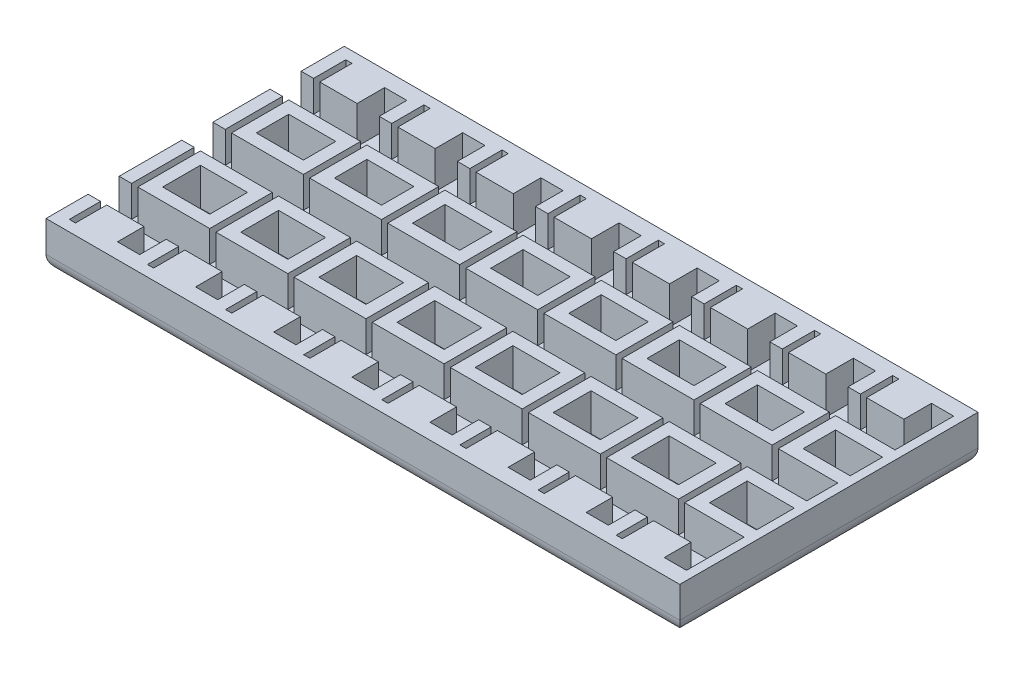
from build123d import *

# Parameters (mm, degrees)
SKETCH1_W                                    = 204
SKETCH1_H                                    = 96
BOSS_EXTRUDE1_DEPTH                          = 15
SKETCH2_W                                    = 2
SKETCH2_H                                    = 89
CUT_EXTRUDE1_DEPTH                           = 10
SKETCH3_W                                    = 8
SKETCH3_H                                    = 10
CUT_EXTRUDE2_DEPTH                           = 12
FILLET1_R                                    = 5
SKETCH5_W                                    = 15.146
SKETCH5_H                                    = 10.425
SKETCH5_H_2                                  = 12.15
SKETCH5_W_2                                  = 7.146
SKETCH5_H_3                                  = 10
SKETCH5_H_4                                  = 18.875
SKETCH5_H_5                                  = 18.55
CUT_EXTRUDE3_DEPTH                           = 12
LPATTERN1_COUNT                              = 8
LPATTERN1_PITCH                              = 25.146
CSK_FOR_M4_HEX_SOCKET_COUNTERSUNK_CA_2_COUNT = 2
CSK_FOR_M4_HEX_SOCKET_COUNTERSUNK_CA_2_PITCH = 129.241712231
CSK_FOR_M4_HEX_SOCKET_COUNTERSUNK_CA_3_COUNT = 2
CSK_FOR_M4_HEX_SOCKET_COUNTERSUNK_CA_3_PITCH = 125.709217873
CSK_FOR_M4_HEX_SOCKET_COUNTERSUNK_CA_4_COUNT = 2
CSK_FOR_M4_HEX_SOCKET_COUNTERSUNK_CA_4_PITCH = 29.040465592
SKETCH9_W                                    = 201.168
SKETCH9_H                                    = 10
CUT_EXTRUDE4_DEPTH                           = 12


with BuildPart() as part:
    # Sketch1 → Boss-Extrude1 (new body)
    with BuildSketch(Plane(origin=(0, 0, 0), x_dir=(1, 0, 0), z_dir=(0, 1, 0))):
        Rectangle(SKETCH1_W, SKETCH1_H)
    extrude(amount=BOSS_EXTRUDE1_DEPTH)

    # Sketch2 → Cut-Extrude1 (cut)
    with BuildSketch(Plane(origin=(0, 15, 0), x_dir=(1, 0, 0), z_dir=(0, 1, 0))):
        with Locations((-97, 0)):
            Rectangle(SKETCH2_W, SKETCH2_H)
        with Locations((-71.854, 0)):
            Rectangle(SKETCH2_W, SKETCH2_H)
        with Locations((-46.708, 0)):
            Rectangle(SKETCH2_W, SKETCH2_H)
        with Locations((-21.562, 0)):
            Rectangle(SKETCH2_W, SKETCH2_H)
        with Locations((3.584, 0)):
            Rectangle(SKETCH2_W, SKETCH2_H)
        with Locations((28.73, 0)):
            Rectangle(SKETCH2_W, SKETCH2_H)
        with Locations((53.876, 0)):
            Rectangle(SKETCH2_W, SKETCH2_H)
        with Locations((79.022, 0)):
            Rectangle(SKETCH2_W, SKETCH2_H)
    extrude(amount=-CUT_EXTRUDE1_DEPTH, mode=Mode.SUBTRACT)

    # Sketch3 → Cut-Extrude2 (cut)
    with BuildSketch(Plane(origin=(0, 15, 0), x_dir=(1, 0, 0), z_dir=(0, 1, 0))):
        with Locations((-92, 0.7)):
            Rectangle(SKETCH3_W, SKETCH3_H)
        with Locations((-92, 29.125)):
            Rectangle(SKETCH3_W, SKETCH3_H)
        with Locations((-92, -29.45)):
            Rectangle(SKETCH3_W, SKETCH3_H)
        with Locations((-66.854, 29.125)):
            Rectangle(SKETCH3_W, SKETCH3_H)
        with Locations((-66.854, 0.7)):
            Rectangle(SKETCH3_W, SKETCH3_H)
        with Locations((-66.854, -29.45)):
            Rectangle(SKETCH3_W, SKETCH3_H)
        with Locations((-41.708, 29.125)):
            Rectangle(SKETCH3_W, SKETCH3_H)
        with Locations((-41.708, 0.7)):
            Rectangle(SKETCH3_W, SKETCH3_H)
        with Locations((-41.708, -29.45)):
            Rectangle(SKETCH3_W, SKETCH3_H)
        with Locations((-16.562, 29.125)):
            Rectangle(SKETCH3_W, SKETCH3_H)
        with Locations((-16.562, 0.7)):
            Rectangle(SKETCH3_W, SKETCH3_H)
        with Locations((-16.562, -29.45)):
            Rectangle(SKETCH3_W, SKETCH3_H)
        with Locations((8.584, 29.125)):
            Rectangle(SKETCH3_W, SKETCH3_H)
        with Locations((8.584, 0.7)):
            Rectangle(SKETCH3_W, SKETCH3_H)
        with Locations((8.584, -29.45)):
            Rectangle(SKETCH3_W, SKETCH3_H)
        with Locations((33.73, 29.125)):
            Rectangle(SKETCH3_W, SKETCH3_H)
        with Locations((33.73, 0.7)):
            Rectangle(SKETCH3_W, SKETCH3_H)
        with Locations((33.73, -29.45)):
            Rectangle(SKETCH3_W, SKETCH3_H)
        with Locations((58.876, 29.125)):
            Rectangle(SKETCH3_W, SKETCH3_H)
        with Locations((58.876, 0.7)):
            Rectangle(SKETCH3_W, SKETCH3_H)
        with Locations((58.876, -29.45)):
            Rectangle(SKETCH3_W, SKETCH3_H)
        with Locations((84.022, 29.125)):
            Rectangle(SKETCH3_W, SKETCH3_H)
        with Locations((84.022, 0.7)):
            Rectangle(SKETCH3_W, SKETCH3_H)
        with Locations((84.022, -29.45)):
            Rectangle(SKETCH3_W, SKETCH3_H)
    extrude(amount=-CUT_EXTRUDE2_DEPTH, mode=Mode.SUBTRACT)

    # Fillet1
    fillet1_edges = [part.edges().sort_by_distance(p)[0] for p in [
        (0, 0, 48),
        (-102, 0, 0),
        (0, 0, -48),
        (102, 0, 0),
    ]]
    fillet(fillet1_edges, radius=FILLET1_R)

    # Sketch5 → Cut-Extrude3 (cut)
    with BuildSketch(Plane(origin=(0, 15, 0), x_dir=(1, 0, 0), z_dir=(0, 1, 0))):
        with Locations((-84.427, 14.9125)):
            Rectangle(SKETCH5_W, SKETCH5_H)
        with Locations((-84.427, -14.375)):
            Rectangle(SKETCH5_W, SKETCH5_H_2)
        with Locations((-80.427, 0.7)):
            Rectangle(SKETCH5_W_2, SKETCH5_H_3)
        with Locations((-80.427, 33.5625)):
            Rectangle(SKETCH5_W_2, SKETCH5_H_4)
        with Locations((-80.427, -33.725)):
            Rectangle(SKETCH5_W_2, SKETCH5_H_5)
    cut_extrude3 = extrude(amount=-CUT_EXTRUDE3_DEPTH, mode=Mode.SUBTRACT)

    # LPattern1: Cut-Extrude3 ×8
    with Locations(*[(i * LPATTERN1_PITCH, 0, 0) for i in range(1, LPATTERN1_COUNT)]):
        add(cut_extrude3, mode=Mode.SUBTRACT)

    # Sketch8 → CSK for M4 Hex Socket Countersunk Cap Screw1 (revolve, cut)
    with BuildSketch(Plane(origin=(-59.360217873, 3, -14.665465592), x_dir=(0, 0, 1), z_dir=(1, 0, 0))):
        Polygon((0, 0), (0, 3), (2.25, 3), (2.25, 2.23), (4.48, 0), align=None)
    csk_for_m4_hex_socket_countersunk_cap_sc = revolve(axis=Axis((-59.360217873, 9.35, -14.665465592), (0, -1, 0)), mode=Mode.SUBTRACT)

    # CSK for M4 Hex Socket Countersunk Ca 2: CSK for M4 Hex Socket Countersunk Cap Screw1 ×2
    with Locations(*[Vector(0.9744282537243548, 0, 0.22469886146508294) * (i * CSK_FOR_M4_HEX_SOCKET_COUNTERSUNK_CA_2_PITCH) for i in range(1, CSK_FOR_M4_HEX_SOCKET_COUNTERSUNK_CA_2_COUNT)]):
        add(csk_for_m4_hex_socket_countersunk_cap_sc, mode=Mode.SUBTRACT)

    # CSK for M4 Hex Socket Countersunk Ca 3: CSK for M4 Hex Socket Countersunk Cap Screw1 ×2
    with Locations(*[(i * CSK_FOR_M4_HEX_SOCKET_COUNTERSUNK_CA_3_PITCH, 0, 0) for i in range(1, CSK_FOR_M4_HEX_SOCKET_COUNTERSUNK_CA_3_COUNT)]):
        add(csk_for_m4_hex_socket_countersunk_cap_sc, mode=Mode.SUBTRACT)

    # CSK for M4 Hex Socket Countersunk Ca 4: CSK for M4 Hex Socket Countersunk Cap Screw1 ×2
    with Locations(*[(0, 0, i * CSK_FOR_M4_HEX_SOCKET_COUNTERSUNK_CA_4_PITCH) for i in range(1, CSK_FOR_M4_HEX_SOCKET_COUNTERSUNK_CA_4_COUNT)]):
        add(csk_for_m4_hex_socket_countersunk_cap_sc, mode=Mode.SUBTRACT)

    # Sketch9 → Cut-Extrude4 (cut)
    with BuildSketch(Plane(origin=(0, 15, 0), x_dir=(1, 0, 0), z_dir=(0, 1, 0))):
        with Locations((-1.416, 29.125)):
            Rectangle(SKETCH9_W, SKETCH9_H)
        with Locations((-1.416, 0.7)):
            Rectangle(SKETCH9_W, SKETCH9_H)
        with Locations((-1.416, -29.45)):
            Rectangle(SKETCH9_W, SKETCH9_H)
    extrude(amount=-CUT_EXTRUDE4_DEPTH, mode=Mode.SUBTRACT)


solid = part.part
